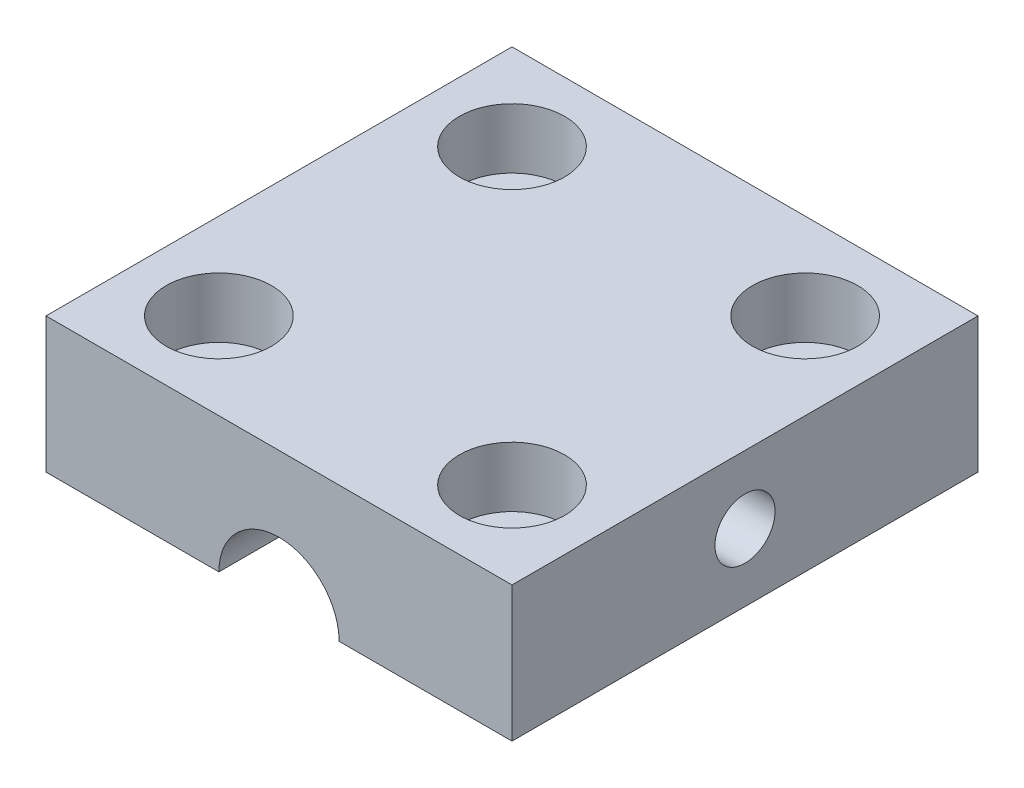
from build123d import *

# Parameters (mm, degrees)
P_IDAT_VYSUNUT_M1_DEPTH  = 31
SKICA3_R                 = 3.5
ODEBRAT_VYSUNUT_M1_DEPTH = 4
SKICA4_R                 = 2
ODEBRAT_VYSUNUT_M2_DEPTH = 36.80851854
SKICA5_R                 = 2
ODEBRAT_VYSUNUT_M3_DEPTH = 10


with BuildPart() as part:
    # Skica2 → Přidat vysunutím1 (new body)
    with BuildSketch(Plane.XY):
        with BuildLine():
            Line((15.5, -4.5), (15.5, 4.5))
            Line((15.5, 4.5), (-15.5, 4.5))
            Line((-15.5, 4.5), (-15.5, -4.5))
            Line((-15.5, -4.5), (-4, -4.5))
            ThreePointArc((-4, -4.5), (0, -0.5), (4, -4.5))
            Line((4, -4.5), (15.5, -4.5))
        make_face()
    extrude(amount=P_IDAT_VYSUNUT_M1_DEPTH)

    # Skica3 → Odebrat vysunutím1 (cut)
    with BuildSketch(Plane(origin=(0, 4.5, 0), x_dir=(1, 0, 0), z_dir=(0, 1, 0))):
        with Locations(Location((9.75, -5.75, 0), (0, 0, 270))):
            Circle(SKICA3_R)
        with Locations(Location((9.75, -25.25, 0), (0, 0, 90))):
            Circle(SKICA3_R)
        with Locations(Location((-9.75, -5.75, 0), (0, 0, 90))):
            Circle(SKICA3_R)
        with Locations(Location((-9.75, -25.25, 0), (0, 0, 270))):
            Circle(SKICA3_R)
    extrude(amount=-ODEBRAT_VYSUNUT_M1_DEPTH, mode=Mode.SUBTRACT)

    # Skica4 → Odebrat vysunutím2 (cut, through all)
    with BuildSketch(Plane(origin=(0, 4.5, 0), x_dir=(1, 0, 0), z_dir=(0, 1, 0))):
        with Locations(Location((9.75, -5.75, 0), (0, 0, 270))):
            Circle(SKICA4_R)
        with Locations(Location((-9.75, -5.75, 0), (0, 0, 270))):
            Circle(SKICA4_R)
        with Locations(Location((-9.75, -25.25, 0), (0, 0, 270))):
            Circle(SKICA4_R)
        with Locations(Location((9.75, -25.25, 0), (0, 0, 270))):
            Circle(SKICA4_R)
    extrude(amount=-ODEBRAT_VYSUNUT_M2_DEPTH, mode=Mode.SUBTRACT)

    # Skica5 → Odebrat vysunutím3 (cut)
    with BuildSketch(Plane(origin=(15.5, 0, 0), x_dir=(0, 0, -1), z_dir=(1, 0, 0))):
        with Locations((-15.5, 0)):
            Circle(SKICA5_R)
    extrude(amount=-ODEBRAT_VYSUNUT_M3_DEPTH, mode=Mode.SUBTRACT)


solid = part.part
